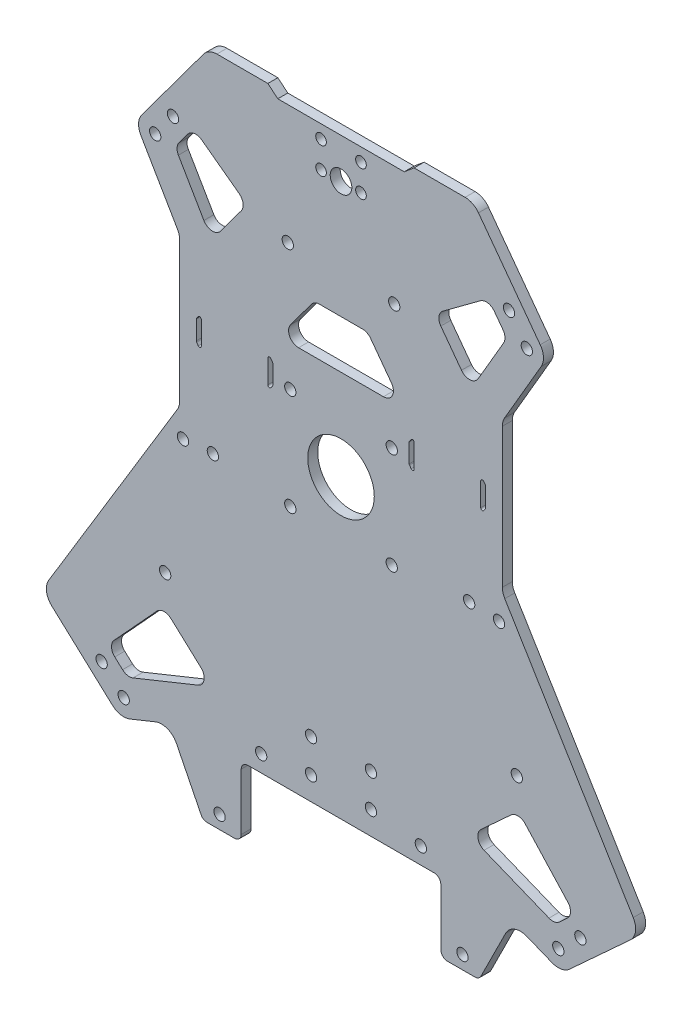
from build123d import *

# Parameters (mm, degrees)
BOSS_EXTRUDE1_DEPTH  = 3
SKETCH1_3_R          = 1.6
CUT_EXTRUDE1_DEPTH   = 219.410327582
FILLET1_R            = 5
FILLET2_R            = 2
M3_CLEARANCE_HOLE2_D = 3.4
M3_CLEARANCE_HOLE3_D = 3.4
FILLET1_OF_MIRROR2_R = 5
FILLET2_OF_MIRROR2_R = 2
M3_CLEARANCE_HOLE4_D = 3.4
CUT_EXTRUDE2_REACH   = 219.837
SKETCH12_R           = 3.25
SKETCH12_R_2         = 1.6
SKETCH12_R_3         = 10


with BuildPart() as part:
    # Sketch1 → Boss-Extrude1 (new body)
    with BuildSketch(Plane.XY):
        Polygon((0, 0), (19, 0), (21.979383981, 2.5), (39.821592002, 2.5), (61.830035112, -27.242703843), (48.5, -50.145982296), (48.5, -94.813552722), (89.961498401, -163.230978502), (66.372111015, -184.85367035), (51.536202762, -178.862357781), (41.5, -199), (30, -199), (30, -178), (0, -178), align=None)
    boss_extrude1 = extrude(amount=BOSS_EXTRUDE1_DEPTH)

    # Sketch1<3> → Cut-Extrude1 (cut, through all)
    with BuildSketch(Plane.XY):
        with Locations((6, -4)):
            Circle(SKETCH1_3_R)
    cut_extrude1 = extrude(amount=CUT_EXTRUDE1_DEPTH, mode=Mode.SUBTRACT)

    # Fillet1
    fillet1_edges = [part.edges().sort_by_distance(p)[0] for p in [
        (51.536202762, -178.862357781, 1.5),
        (66.372111015, -184.85367035, 1.5),
        (89.961498401, -163.230978502, 1.5),
        (48.5, -94.813552722, 1.5),
        (48.5, -50.145982296, 1.5),
        (61.830035112, -27.242703843, 1.5),
        (39.821592002, 2.5, 1.5),
    ]]
    fillet(fillet1_edges, radius=FILLET1_R)

    # Fillet2
    fillet2_edges = [part.edges().sort_by_distance(p)[0] for p in [
        (30, -178, 1.5),
        (30, -199, 1.5),
        (41.5, -199, 1.5),
    ]]
    fillet(fillet2_edges, radius=FILLET2_R)

    # M3 Clearance Hole2 (through all)
    with Locations(Plane.XY.offset(3)):
        with Locations((65.319158384, -179.03612505), (71.953673586, -172.954742967), (52.849782983, -140.273840841), (47.493235343, -102.79975116), (38.515884824, -102.16164642), (55.853405081, -27.571616841), (50.5, -20.336905095), (15.998713863, -35.91449332)):
            m3_clearance_hole2 = Hole(M3_CLEARANCE_HOLE2_D / 2)

    # M3 Clearance Hole3 (through all)
    with Locations(Plane.XY.offset(3)):
        with Locations((9, -171), (24, -173), (9, -161), (36.5, -195)):
            m3_clearance_hole3 = Hole(M3_CLEARANCE_HOLE3_D / 2)

    # Mirror2: Boss-Extrude1, Cut-Extrude1, M3 Clearance Hole2, M3 Clearance Hole3 across plane
    add(boss_extrude1.mirror(Plane(origin=(0, 0, 3), x_dir=(0, 0, 1), z_dir=(1, 0, 0))))
    add(cut_extrude1.mirror(Plane(origin=(0, 0, 3), x_dir=(0, 0, 1), z_dir=(1, 0, 0))), mode=Mode.SUBTRACT)
    add(m3_clearance_hole2.mirror(Plane(origin=(0, 0, 3), x_dir=(0, 0, 1), z_dir=(1, 0, 0))), mode=Mode.SUBTRACT)
    add(m3_clearance_hole3.mirror(Plane(origin=(0, 0, 3), x_dir=(0, 0, 1), z_dir=(1, 0, 0))), mode=Mode.SUBTRACT)

    # Fillet1 of Mirror2
    fillet1_of_mirror2_edges = [part.edges().sort_by_distance(p)[0] for p in [
        (-51.536202762, -178.862357781, 1.5),
        (-66.372111015, -184.85367035, 1.5),
        (-89.961498401, -163.230978502, 1.5),
        (-48.5, -94.813552722, 1.5),
        (-48.5, -50.145982296, 1.5),
        (-61.830035112, -27.242703843, 1.5),
        (-39.821592002, 2.5, 1.5),
    ]]
    fillet(fillet1_of_mirror2_edges, radius=FILLET1_OF_MIRROR2_R)

    # Fillet2 of Mirror2
    fillet2_of_mirror2_edges = [part.edges().sort_by_distance(p)[0] for p in [
        (-30, -178, 1.5),
        (-30, -199, 1.5),
        (-41.5, -199, 1.5),
    ]]
    fillet(fillet2_of_mirror2_edges, radius=FILLET2_OF_MIRROR2_R)

    # M3 Clearance Hole4 (through all)
    with Locations(Plane.XY.offset(3)):
        with Locations((15.25, -104.25), (-15.25, -104.25), (15.25, -73.75), (-15.25, -73.75)):
            Hole(M3_CLEARANCE_HOLE4_D / 2)

    # Sketch12 → Cut-Extrude2 (cut, up to next)
    with BuildSketch(Plane.XY.offset(3), mode=Mode.PRIVATE) as cut_extrude2_sk1:
        with Locations((0, -12)):
            Circle(SKETCH12_R)
    cut_extrude2_tool1 = extrude(cut_extrude2_sk1.sketch, amount=-CUT_EXTRUDE2_REACH, mode=Mode.PRIVATE) & part.part
    # Sketch12 → Cut-Extrude2 (cut, up to next)
    with BuildSketch(Plane.XY.offset(3), mode=Mode.PRIVATE) as cut_extrude2_sk2:
        with Locations((6, -12)):
            Circle(SKETCH12_R_2)
    cut_extrude2_tool2 = extrude(cut_extrude2_sk2.sketch, amount=-CUT_EXTRUDE2_REACH, mode=Mode.PRIVATE) & part.part
    # Sketch12 → Cut-Extrude2 (cut, up to next)
    with BuildSketch(Plane.XY.offset(3), mode=Mode.PRIVATE) as cut_extrude2_sk3:
        with Locations((-6, -12)):
            Circle(SKETCH12_R_2)
    cut_extrude2_tool3 = extrude(cut_extrude2_sk3.sketch, amount=-CUT_EXTRUDE2_REACH, mode=Mode.PRIVATE) & part.part
    # Sketch12 → Cut-Extrude2 (cut, up to next)
    with BuildSketch(Plane.XY.offset(3), mode=Mode.PRIVATE) as cut_extrude2_sk4:
        with Locations((0, -89)):
            Circle(SKETCH12_R_3)
    cut_extrude2_tool4 = extrude(cut_extrude2_sk4.sketch, amount=-CUT_EXTRUDE2_REACH, mode=Mode.PRIVATE) & part.part
    # Sketch12 → Cut-Extrude2 (cut, up to next)
    with BuildSketch(Plane.XY.offset(3), mode=Mode.PRIVATE) as cut_extrude2_sk5:
        with BuildLine():
            Line((-41.881813558, -22.139478444), (-30.627817509, -30.466997458))
            ThreePointArc((-30.627817509, -30.466997458), (-29.445238279, -32.435139807), (-30.000715288, -34.6630364))
            Line((-30.000715288, -34.6630364), (-36.211623877, -43.056597628))
            ThreePointArc((-36.211623877, -43.056597628), (-38.788044571, -44.267596583), (-41.216018434, -42.781189846))
            Line((-41.216018434, -42.781189846), (-48.883621007, -29.606938217))
            ThreePointArc((-48.883621007, -29.606938217), (-49.286264347, -27.933027525), (-48.702367613, -26.313409278))
            Line((-48.702367613, -26.313409278), (-46.0778525, -22.766580665))
            ThreePointArc((-46.0778525, -22.766580665), (-44.109710151, -21.584001436), (-41.881813558, -22.139478444))
        make_face()
    cut_extrude2_tool5 = extrude(cut_extrude2_sk5.sketch, amount=-CUT_EXTRUDE2_REACH, mode=Mode.PRIVATE) & part.part
    # Sketch12 → Cut-Extrude2 (cut, up to next)
    with BuildSketch(Plane.XY.offset(3), mode=Mode.PRIVATE) as cut_extrude2_sk6:
        with BuildLine():
            Line((41.216018434, -42.781189846), (48.883621007, -29.606938217))
            ThreePointArc((48.883621007, -29.606938217), (49.286264347, -27.933027525), (48.702367613, -26.313409278))
            Line((48.702367613, -26.313409278), (46.0778525, -22.766580665))
            ThreePointArc((46.0778525, -22.766580665), (44.109710151, -21.584001436), (41.881813558, -22.139478444))
            Line((41.881813558, -22.139478444), (30.627817509, -30.466997458))
            ThreePointArc((30.627817509, -30.466997458), (29.445238279, -32.435139807), (30.000715288, -34.6630364))
            Line((30.000715288, -34.6630364), (36.211623877, -43.056597628))
            ThreePointArc((36.211623877, -43.056597628), (38.788044571, -44.267596583), (41.216018434, -42.781189846))
        make_face()
    cut_extrude2_tool6 = extrude(cut_extrude2_sk6.sketch, amount=-CUT_EXTRUDE2_REACH, mode=Mode.PRIVATE) & part.part
    # Sketch12 → Cut-Extrude2 (cut, up to next)
    with BuildSketch(Plane.XY.offset(3), mode=Mode.PRIVATE) as cut_extrude2_sk7:
        with BuildLine():
            Line((65.661561535, -171.939557637), (68.007786071, -169.788942645))
            ThreePointArc((68.007786071, -169.788942645), (68.977824443, -167.707812304), (68.192163778, -165.550310217))
            Line((68.192163778, -165.550310217), (55.353690493, -151.544111456))
            ThreePointArc((55.353690493, -151.544111456), (53.272560152, -150.574073084), (51.115058065, -151.35973375))
            Line((51.115058065, -151.35973375), (42.088219413, -159.633986376))
            ThreePointArc((42.088219413, -159.633986376), (41.163310825, -162.379798245), (42.991975667, -164.627224241))
            Line((42.991975667, -164.627224241), (62.511063067, -172.509785367))
            ThreePointArc((62.511063067, -172.509785367), (64.168740975, -172.680088518), (65.661561535, -171.939557637))
        make_face()
    cut_extrude2_tool7 = extrude(cut_extrude2_sk7.sketch, amount=-CUT_EXTRUDE2_REACH, mode=Mode.PRIVATE) & part.part
    # Sketch12 → Cut-Extrude2 (cut, up to next)
    with BuildSketch(Plane.XY.offset(3), mode=Mode.PRIVATE) as cut_extrude2_sk8:
        with BuildLine():
            Line((-51.115058065, -151.35973375), (-42.088219413, -159.633986376))
            ThreePointArc((-42.088219413, -159.633986376), (-41.163310825, -162.379798245), (-42.991975667, -164.627224241))
            Line((-42.991975667, -164.627224241), (-62.511063067, -172.509785367))
            ThreePointArc((-62.511063067, -172.509785367), (-64.168740975, -172.680088518), (-65.661561535, -171.939557637))
            Line((-65.661561535, -171.939557637), (-68.007786071, -169.788942645))
            ThreePointArc((-68.007786071, -169.788942645), (-68.977824443, -167.707812304), (-68.192163778, -165.550310217))
            Line((-68.192163778, -165.550310217), (-55.353690493, -151.544111456))
            ThreePointArc((-55.353690493, -151.544111456), (-53.272560152, -150.574073084), (-51.115058065, -151.35973375))
        make_face()
    cut_extrude2_tool8 = extrude(cut_extrude2_sk8.sketch, amount=-CUT_EXTRUDE2_REACH, mode=Mode.PRIVATE) & part.part
    # Sketch12 → Cut-Extrude2 (cut, up to next)
    with BuildSketch(Plane.XY.offset(3), mode=Mode.PRIVATE) as cut_extrude2_sk9:
        with BuildLine():
            Line((6.487875517, -47.210701628), (-6.487875517, -47.210701628))
            ThreePointArc((-6.487875517, -47.210701628), (-7.83817084, -47.531764798), (-8.899446099, -48.426233268))
            Line((-8.899446099, -48.426233268), (-15.16648981, -56.895656759))
            ThreePointArc((-15.16648981, -56.895656759), (-15.433856059, -60.030420442), (-12.754919228, -61.680125119))
            Line((-12.754919228, -61.680125119), (12.754919228, -61.680125119))
            ThreePointArc((12.754919228, -61.680125119), (15.433856059, -60.030420442), (15.16648981, -56.895656759))
            Line((15.16648981, -56.895656759), (8.899446099, -48.426233268))
            ThreePointArc((8.899446099, -48.426233268), (7.83817084, -47.531764798), (6.487875517, -47.210701628))
        make_face()
    cut_extrude2_tool9 = extrude(cut_extrude2_sk9.sketch, amount=-CUT_EXTRUDE2_REACH, mode=Mode.PRIVATE) & part.part
    # Sketch12 → Cut-Extrude2 (cut, up to next)
    with BuildSketch(Plane.XY.offset(3), mode=Mode.PRIVATE) as cut_extrude2_sk10:
        with BuildLine():
            Line((42, -75.955926292), (42, -68.955926292))
            ThreePointArc((42, -68.955926292), (42.341886117, -68.481584643), (42.9, -68.655926292))
            Line((42.9, -68.655926292), (43.4, -69.322592958))
            ThreePointArc((43.4, -69.322592958), (43.474341649, -69.464479075), (43.5, -69.622592958))
            Line((43.5, -69.622592958), (43.5, -75.289259625))
            ThreePointArc((43.5, -75.289259625), (43.474341649, -75.447373508), (43.4, -75.589259625))
            Line((43.4, -75.589259625), (42.9, -76.255926292))
            ThreePointArc((42.9, -76.255926292), (42.341886117, -76.430267941), (42, -75.955926292))
        make_face()
    cut_extrude2_tool10 = extrude(cut_extrude2_sk10.sketch, amount=-CUT_EXTRUDE2_REACH, mode=Mode.PRIVATE) & part.part
    # Sketch12 → Cut-Extrude2 (cut, up to next)
    with BuildSketch(Plane.XY.offset(3), mode=Mode.PRIVATE) as cut_extrude2_sk11:
        with BuildLine():
            Line((22, -75.955926292), (22, -68.955926292))
            ThreePointArc((22, -68.955926292), (21.658113883, -68.481584643), (21.1, -68.655926292))
            Line((21.1, -68.655926292), (20.6, -69.322592958))
            ThreePointArc((20.6, -69.322592958), (20.525658351, -69.464479075), (20.5, -69.622592958))
            Line((20.5, -69.622592958), (20.5, -75.289259625))
            ThreePointArc((20.5, -75.289259625), (20.525658351, -75.447373508), (20.6, -75.589259625))
            Line((20.6, -75.589259625), (21.1, -76.255926292))
            ThreePointArc((21.1, -76.255926292), (21.658113883, -76.430267941), (22, -75.955926292))
        make_face()
    cut_extrude2_tool11 = extrude(cut_extrude2_sk11.sketch, amount=-CUT_EXTRUDE2_REACH, mode=Mode.PRIVATE) & part.part
    # Sketch12 → Cut-Extrude2 (cut, up to next)
    with BuildSketch(Plane.XY.offset(3), mode=Mode.PRIVATE) as cut_extrude2_sk12:
        with BuildLine():
            Line((-43.4, -75.589259625), (-42.9, -76.255926292))
            ThreePointArc((-42.9, -76.255926292), (-42.341886117, -76.430267941), (-42, -75.955926292))
            Line((-42, -75.955926292), (-42, -68.955926292))
            ThreePointArc((-42, -68.955926292), (-42.341886117, -68.481584643), (-42.9, -68.655926292))
            Line((-42.9, -68.655926292), (-43.4, -69.322592958))
            ThreePointArc((-43.4, -69.322592958), (-43.474341649, -69.464479075), (-43.5, -69.622592958))
            Line((-43.5, -69.622592958), (-43.5, -75.289259625))
            ThreePointArc((-43.5, -75.289259625), (-43.474341649, -75.447373508), (-43.4, -75.589259625))
        make_face()
    cut_extrude2_tool12 = extrude(cut_extrude2_sk12.sketch, amount=-CUT_EXTRUDE2_REACH, mode=Mode.PRIVATE) & part.part
    # Sketch12 → Cut-Extrude2 (cut, up to next)
    with BuildSketch(Plane.XY.offset(3), mode=Mode.PRIVATE) as cut_extrude2_sk13:
        with BuildLine():
            Line((-20.6, -75.589259625), (-21.1, -76.255926292))
            ThreePointArc((-21.1, -76.255926292), (-21.658113883, -76.430267941), (-22, -75.955926292))
            Line((-22, -75.955926292), (-22, -68.955926292))
            ThreePointArc((-22, -68.955926292), (-21.658113883, -68.481584643), (-21.1, -68.655926292))
            Line((-21.1, -68.655926292), (-20.6, -69.322592958))
            ThreePointArc((-20.6, -69.322592958), (-20.525658351, -69.464479075), (-20.5, -69.622592958))
            Line((-20.5, -69.622592958), (-20.5, -75.289259625))
            ThreePointArc((-20.5, -75.289259625), (-20.525658351, -75.447373508), (-20.6, -75.589259625))
        make_face()
    cut_extrude2_tool13 = extrude(cut_extrude2_sk13.sketch, amount=-CUT_EXTRUDE2_REACH, mode=Mode.PRIVATE) & part.part
    add(cut_extrude2_tool1.solids().sort_by_distance((0, -12, 3))[0], mode=Mode.SUBTRACT)
    add(cut_extrude2_tool2.solids().sort_by_distance((6, -12, 3))[0], mode=Mode.SUBTRACT)
    add(cut_extrude2_tool3.solids().sort_by_distance((-6, -12, 3))[0], mode=Mode.SUBTRACT)
    add(cut_extrude2_tool4.solids().sort_by_distance((0, -89, 3))[0], mode=Mode.SUBTRACT)
    add(cut_extrude2_tool5.solids().sort_by_distance((-39.651234, -32.486535, 3))[0], mode=Mode.SUBTRACT)
    add(cut_extrude2_tool6.solids().sort_by_distance((39.651234, -32.486535, 3))[0], mode=Mode.SUBTRACT)
    add(cut_extrude2_tool7.solids().sort_by_distance((55.227682, -162.285181, 3))[0], mode=Mode.SUBTRACT)
    add(cut_extrude2_tool8.solids().sort_by_distance((-55.227682, -162.285181, 3))[0], mode=Mode.SUBTRACT)
    add(cut_extrude2_tool9.solids().sort_by_distance((0, -55.209674, 3))[0], mode=Mode.SUBTRACT)
    add(cut_extrude2_tool10.solids().sort_by_distance((42.722087, -72.455926, 3))[0], mode=Mode.SUBTRACT)
    add(cut_extrude2_tool11.solids().sort_by_distance((21.277913, -72.455926, 3))[0], mode=Mode.SUBTRACT)
    add(cut_extrude2_tool12.solids().sort_by_distance((-42.722087, -72.455926, 3))[0], mode=Mode.SUBTRACT)
    add(cut_extrude2_tool13.solids().sort_by_distance((-21.277913, -72.455926, 3))[0], mode=Mode.SUBTRACT)


solid = part.part
